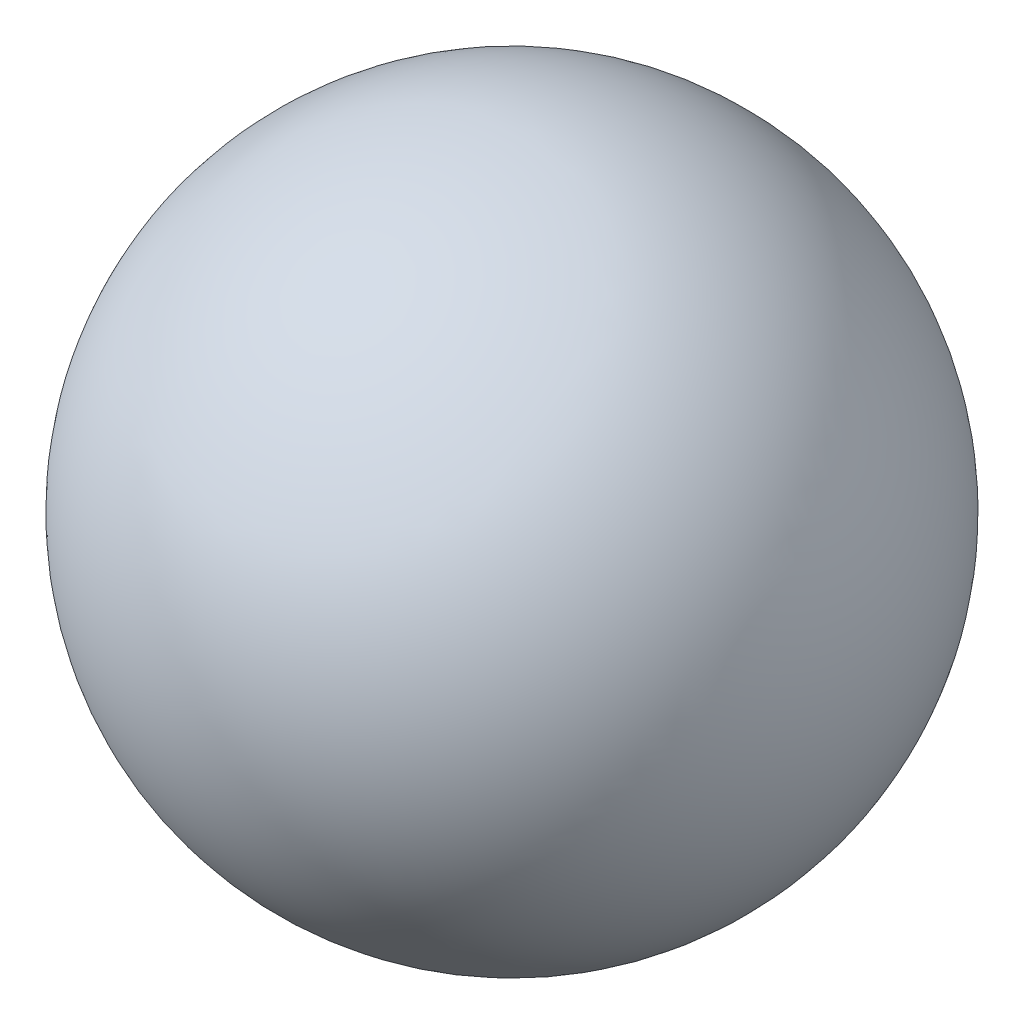
from build123d import *


with BuildPart() as part:
    # Sketch1 → Revolve1 (revolve)
    with BuildSketch(Plane.XY):
        with BuildLine():
            Line((0, 0), (30, 0))
            ThreePointArc((30, 0), (15, 15), (0, 0))
        make_face()
    revolve(axis=Axis((0, 0, 0), (1, 0, 0)))


solid = part.part
